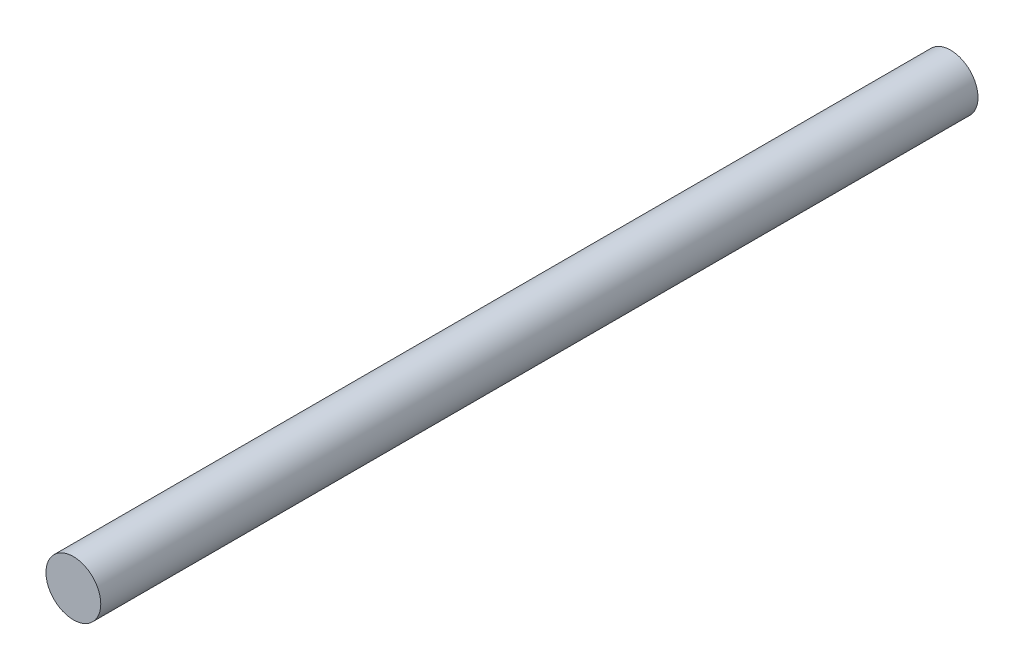
from build123d import *

# Parameters (mm, degrees)
SKETCH1_R           = 12.7
BOSS_EXTRUDE1_DEPTH = 406.4
SCALE1_SCALE        = 0.5


with BuildPart() as part:
    # Sketch1 → Boss-Extrude1 (new body)
    with BuildSketch(Plane.XY):
        Circle(SKETCH1_R)
    extrude(amount=BOSS_EXTRUDE1_DEPTH)


with BuildPart() as part_1:
    # Scale1: scaled about (0, 0, 203.2)
    add(part.part.scale(SCALE1_SCALE).moved(Location((0, 0, 101.6))))


solid = part_1.part
